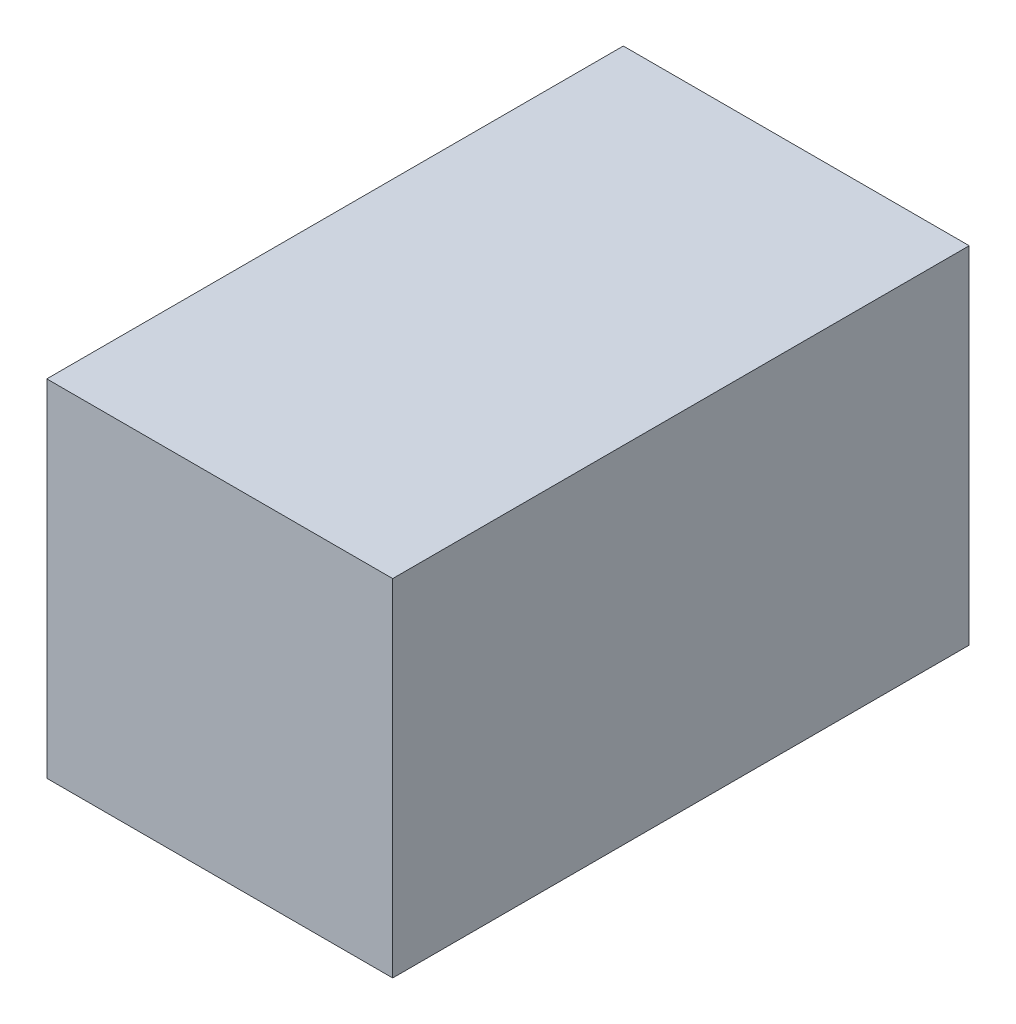
from build123d import *

# Parameters (mm, degrees)
CROQUIS1_W              = 30
CROQUIS1_H              = 30
SALIENTE_EXTRUIR1_DEPTH = 50


with BuildPart() as part:
    # Croquis1 → Saliente-Extruir1 (new body)
    with BuildSketch(Plane.XY):
        Rectangle(CROQUIS1_W, CROQUIS1_H)
    extrude(amount=-SALIENTE_EXTRUIR1_DEPTH)


solid = part.part
